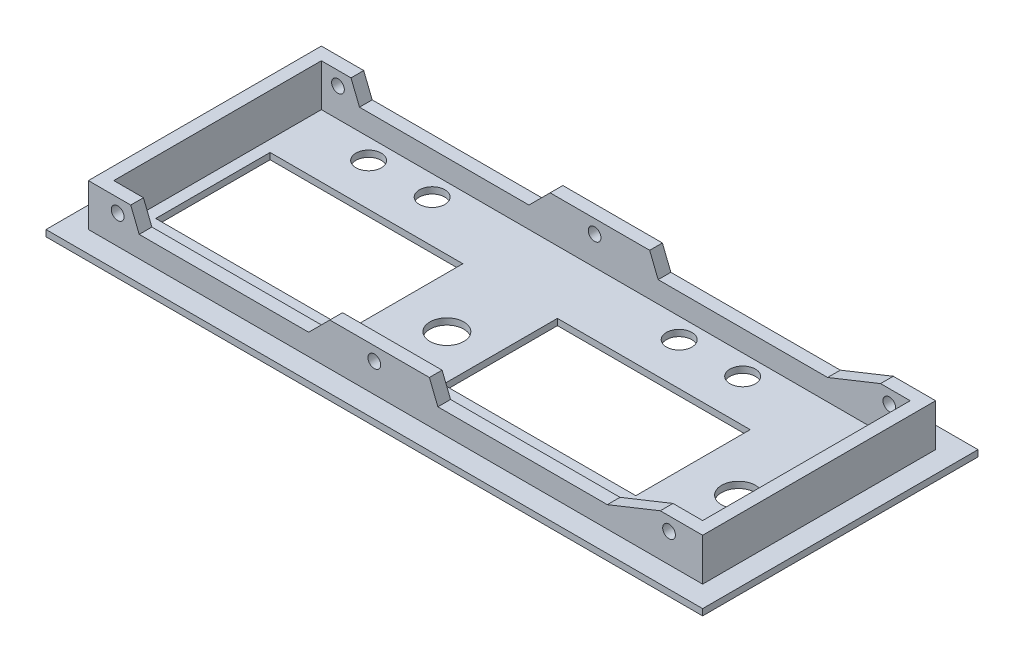
from build123d import *

# Parameters (mm, degrees)
SKETCH1_W           = 155
SKETCH1_H           = 65
BOSS_EXTRUDE1_DEPTH = 1.5
SKETCH2_W           = 145
SKETCH2_H           = 55
SKETCH2_W_2         = 139
SKETCH2_H_2         = 49
BOSS_EXTRUDE2_DEPTH = 10
CUT_EXTRUDE1_DEPTH  = 91
SKETCH5_R           = 3
SKETCH5_R_2         = 4
SKETCH5_W           = 45.5
SKETCH5_H           = 27
CUT_EXTRUDE2_DEPTH  = 91
SKETCH6_R           = 1.5
CUT_EXTRUDE3_DEPTH  = 91


with BuildPart() as part:
    # Sketch1 → Boss-Extrude1 (new body)
    with BuildSketch(Plane(origin=(0, 0, 0), x_dir=(1, 0, 0), z_dir=(0, 1, 0))):
        with Locations((-3.071428571, 5.285714286)):
            Rectangle(SKETCH1_W, SKETCH1_H)
    extrude(amount=BOSS_EXTRUDE1_DEPTH)

    # Sketch2 → Boss-Extrude2 (add)
    with BuildSketch(Plane(origin=(0, 1.5, 0), x_dir=(1, 0, 0), z_dir=(0, 1, 0))):
        with Locations((-3.071428571, 5.285714286)):
            Rectangle(SKETCH2_W, SKETCH2_H)
        with Locations((-3.071428571, 5.285714286)):
            Rectangle(SKETCH2_W_2, SKETCH2_H_2, mode=Mode.SUBTRACT)
    extrude(amount=BOSS_EXTRUDE2_DEPTH)

    # Sketch4 → Cut-Extrude1 (cut)
    with BuildSketch(Plane.XY.offset(22.214285714)):
        Polygon((-65.571428571, 11.5), (-63.571428571, 6.5), (-23.571428571, 6.5), (-18.571428571, 11.5), align=None)
        Polygon((4.928571429, 11.5), (59.428571429, 11.5), (46.928571429, 6.5), (6.928571429, 6.5), align=None)
    extrude(amount=-CUT_EXTRUDE1_DEPTH, mode=Mode.SUBTRACT)

    # Sketch5 → Cut-Extrude2 (cut)
    with BuildSketch(Plane.XZ):
        with Locations(Location((16.687112177, -24.986454546, 0), (0, 0, 270))):
            Circle(SKETCH5_R)
        with Locations(Location((31.687110951, -24.980390104, 0), (0, 0, 270))):
            Circle(SKETCH5_R)
        with Locations(Location((55.455936184, -0.234986803, 0), (0, 0, 270))):
            Circle(SKETCH5_R_2)
        with Locations(Location((-12.375354301, 0.783116326, 0), (0, 0, 270))):
            Circle(SKETCH5_R_2)
        with Locations(Location((-56.616849976, -24.986454546, 0), (0, 0, 270))):
            Circle(SKETCH5_R)
        with Locations(Location((-41.616849976, -24.986454546, 0), (0, 0, 270))):
            Circle(SKETCH5_R)
        with Locations((20.705936184, -1.486454546)):
            Rectangle(SKETCH5_W, SKETCH5_H)
        with Locations((-47.125354301, -1.486454546)):
            Rectangle(SKETCH5_W, SKETCH5_H)
    extrude(amount=-CUT_EXTRUDE2_DEPTH, mode=Mode.SUBTRACT)

    # Sketch6 → Cut-Extrude3 (cut)
    with BuildSketch(Plane.XY.offset(22.214285714)):
        with Locations((-8.074390062, 8.312033368)):
            Circle(SKETCH6_R)
        with Locations((61.496987575, 8.312033368)):
            Circle(SKETCH6_R)
        with Locations((-68.65, 8.3)):
            Circle(SKETCH6_R)
    extrude(amount=-CUT_EXTRUDE3_DEPTH, mode=Mode.SUBTRACT)


solid = part.part
